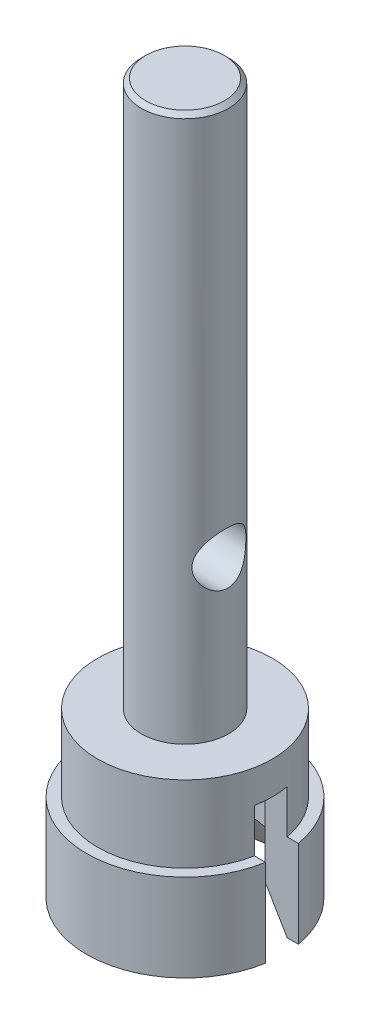
from build123d import *

# Parameters (mm, degrees)
SKETCH_2_R             = 3
CUT_EXTRUDE_1_DEPTH    = 6
CHAMFER_1_SIZE         = 1
CHAMFER_1_SIZE2        = 1.732050808
SKETCH_3_W             = 11
SKETCH_3_H             = 1.5
CUT_EXTRUDE_3_DEPTH    = 6
CHAMFER_2_SIZE         = 0.2
HOLE_WIZARD_M2_1_D     = 2.4
HOLE_WIZARD_M2_1_DEPTH = 10
HOLE_WIZARD_M2_1_TIP   = 0.721032743


with BuildPart() as part:
    # 草图1 → 旋转1 (revolve)
    with BuildSketch(Plane.XY, mode=Mode.PRIVATE) as revolve_1_sk:
        Polygon((0, 0), (-2, 0), (-2, -25), (-4, -25), (-4, -28.5), (-4.5, -28.5), (-4.5, -32.5), (0, -32.5), align=None)
    revolve(revolve_1_sk.sketch.rotate(Axis((0, 0, 0), (0, -1, 0)), 270), axis=Axis((0, 0, 0), (0, -1, 0)))

    # 草图2 → 切除-拉伸1 (cut)
    with BuildSketch(Plane.XZ.offset(32.5)):
        with Locations(Location((0, 0, 0), (0, 0, 270))):
            Circle(SKETCH_2_R)
    extrude(amount=-CUT_EXTRUDE_1_DEPTH, mode=Mode.SUBTRACT)

    # 倒角1
    chamfer_1_edges = [part.edges().sort_by_distance(p)[0] for p in [
        (0, -32.5, 3),
    ]]
    chamfer_1_side = [part.faces().sort_by_distance(p)[0] for p in [
        (0, -32.5, -4.372720779),
    ]]
    chamfer(chamfer_1_edges, length=CHAMFER_1_SIZE, length2=CHAMFER_1_SIZE2, reference=chamfer_1_side[0])

    # 草图3 → 切除-拉伸3 (cut)
    with BuildSketch(Plane.XZ.offset(32.5)):
        Rectangle(SKETCH_3_W, SKETCH_3_H)
    extrude(amount=-CUT_EXTRUDE_3_DEPTH, mode=Mode.SUBTRACT)

    # 倒角2
    chamfer_2_edges = [part.edges().sort_by_distance(p)[0] for p in [
        (0, 0, -2),
    ]]
    chamfer(chamfer_2_edges, length=CHAMFER_2_SIZE)

    # M2 间隙孔1
    with Locations(Plane(origin=(-1.999095, -18, -0.060159626), x_dir=(0.030079813167, 0, -0.999547500042), z_dir=(-0.999547500042, 0, -0.030079813167))):
        with Locations((0, 0)):
            Hole(HOLE_WIZARD_M2_1_D / 2, depth=HOLE_WIZARD_M2_1_DEPTH)
            with Locations((0, 0, -(HOLE_WIZARD_M2_1_DEPTH + HOLE_WIZARD_M2_1_TIP / 2))):  # 118° drill point
                Cone(0, HOLE_WIZARD_M2_1_D / 2, HOLE_WIZARD_M2_1_TIP, mode=Mode.SUBTRACT)


solid = part.part
